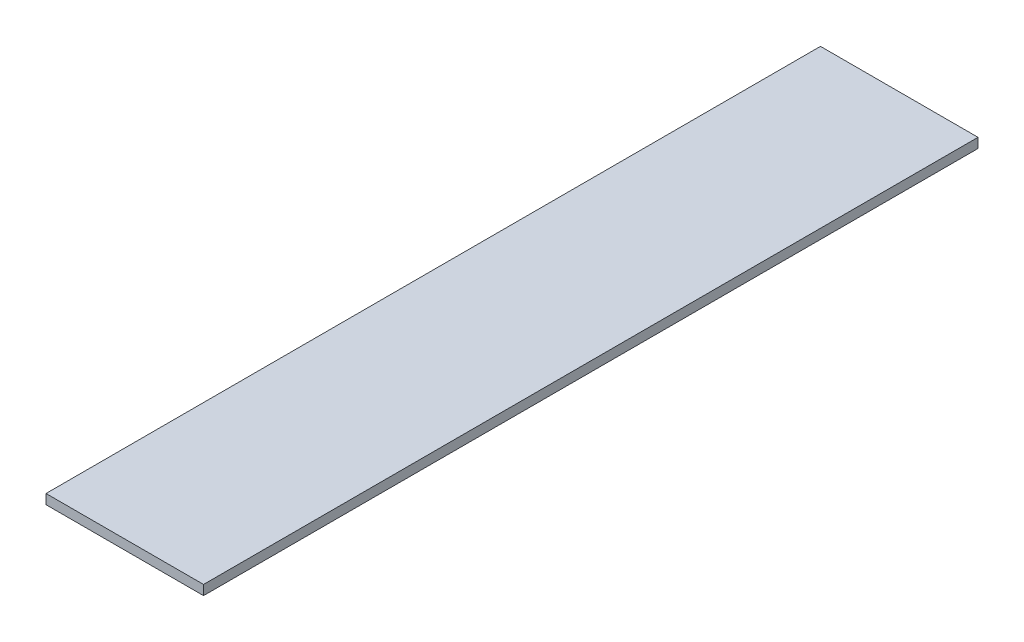
from build123d import *

# Parameters (mm, degrees)
SKETCH1_W           = 19.05
SKETCH1_H           = 1.175
BOSS_EXTRUDE1_DEPTH = 93.65


with BuildPart() as part:
    # Sketch1 → Boss-Extrude1 (new body)
    with BuildSketch(Plane.XY):
        Rectangle(SKETCH1_W, SKETCH1_H)
    extrude(amount=BOSS_EXTRUDE1_DEPTH)


solid = part.part
